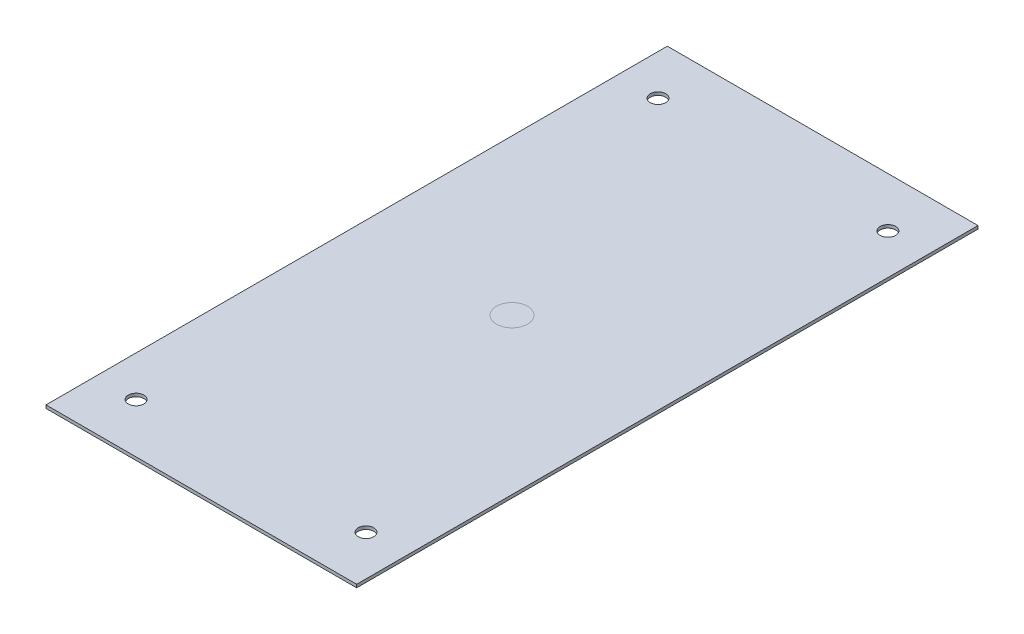
from build123d import *

# Parameters (mm, degrees)
SKETCH1_W               = 100
SKETCH1_H               = 200
BOSS_EXTRUDE1_DEPTH     = 1
SKETCH3_R               = 2.5
CUT_EXTRUDE1_DEPTH      = 112.807870922
MIRROR2_COPY_1_SKETCH_R = 2.5
MIRROR2_COPY_1_DEPTH    = 112.807870922


with BuildPart() as part:
    # Sketch1 → Boss-Extrude1 (new body)
    with BuildSketch(Plane(origin=(0, 0, 0), x_dir=(1, 0, 0), z_dir=(0, 1, 0))):
        Rectangle(SKETCH1_W, SKETCH1_H)
    extrude(amount=BOSS_EXTRUDE1_DEPTH)

    # Sketch3 → Cut-Extrude1 (cut, through all)
    with BuildSketch(Plane(origin=(0, 1, 0), x_dir=(1, 0, 0), z_dir=(0, 1, 0))):
        with Locations(Location((37, 84, 0), (0, 0, 270))):
            Circle(SKETCH3_R)
    cut_extrude1 = extrude(amount=-CUT_EXTRUDE1_DEPTH, mode=Mode.SUBTRACT)

    # Mirror1: Cut-Extrude1 across plane
    add(cut_extrude1.mirror(Plane(origin=(0, 0, 0), x_dir=(0, 0, 1), z_dir=(1, 0, 0))), mode=Mode.SUBTRACT)

    # Mirror2: Cut-Extrude1 across plane
    add(cut_extrude1.mirror(Plane.XY), mode=Mode.SUBTRACT)

    # Mirror2 copy 1 sketch → Mirror2 copy 1 (cut, through all)
    with BuildSketch(Plane(origin=(0, 1, 0), x_dir=(-1, 0, 0), z_dir=(0, 1, 0))):
        with Locations(Location((37, 84, 0), (0, 0, 270))):
            Circle(MIRROR2_COPY_1_SKETCH_R)
    extrude(amount=-MIRROR2_COPY_1_DEPTH, mode=Mode.SUBTRACT)


solid = part.part
